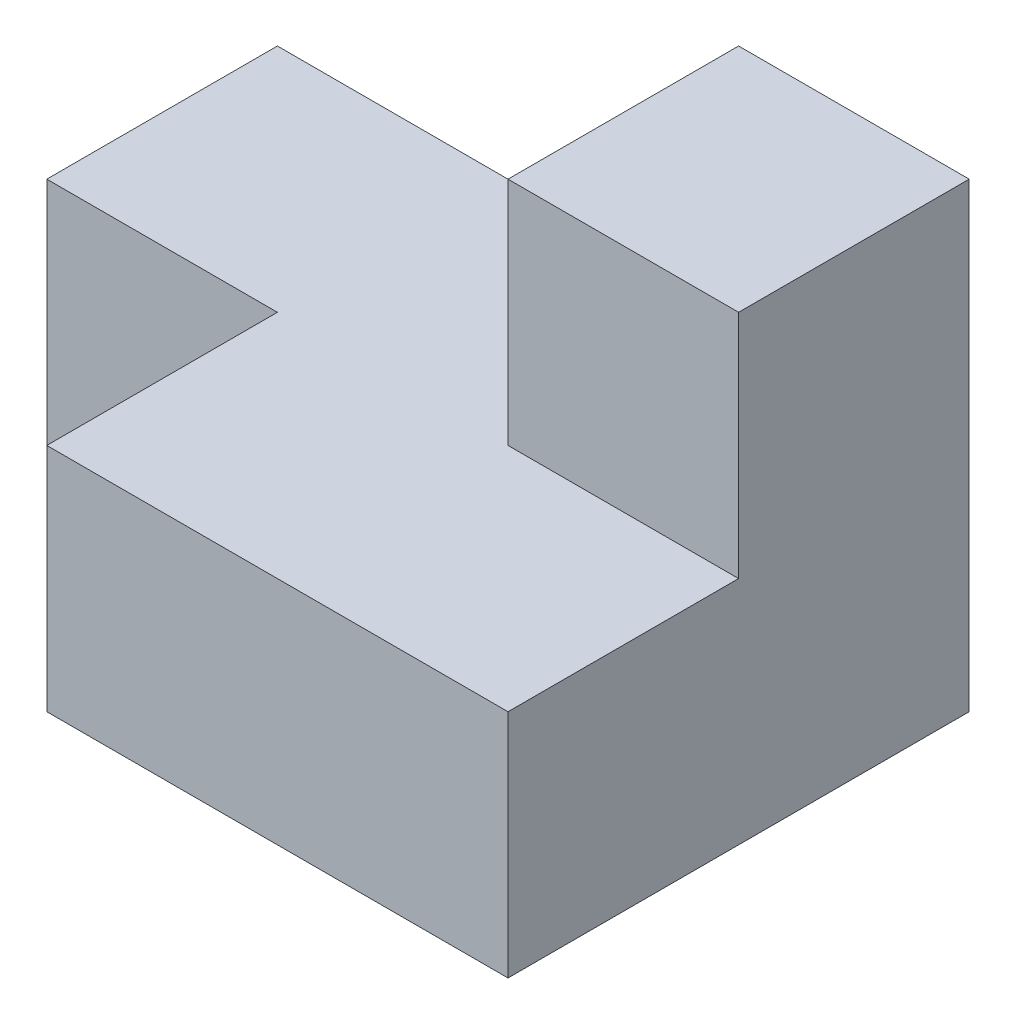
from build123d import *

# Parameters (mm, degrees)
ESBO_O1_W                = 60
ESBO_O1_H                = 20
RESSALTO_EXTRUS_O1_DEPTH = 20
ESBO_O2_W                = 40
ESBO_O2_H                = 20
RESSALTO_EXTRUS_O2_DEPTH = 20
ESBO_O3_W                = 20
ESBO_O3_H                = 20
RESSALTO_EXTRUS_O3_DEPTH = 20


with BuildPart() as part:
    # Esboço1 → Ressalto-extrusão1 (new body)
    with BuildSketch(Plane.XY):
        with Locations((30, 10)):
            Rectangle(ESBO_O1_W, ESBO_O1_H)
    extrude(amount=RESSALTO_EXTRUS_O1_DEPTH)

    # Esboço2 → Ressalto-extrusão2 (add)
    with BuildSketch(Plane.XY.offset(20)):
        with Locations((40, 10)):
            Rectangle(ESBO_O2_W, ESBO_O2_H)
    extrude(amount=RESSALTO_EXTRUS_O2_DEPTH)

    # Esboço3 → Ressalto-extrusão3 (add)
    with BuildSketch(Plane(origin=(0, 20, 0), x_dir=(1, 0, 0), z_dir=(0, 1, 0))):
        with Locations((50, -10)):
            Rectangle(ESBO_O3_W, ESBO_O3_H)
    extrude(amount=RESSALTO_EXTRUS_O3_DEPTH)


solid = part.part
